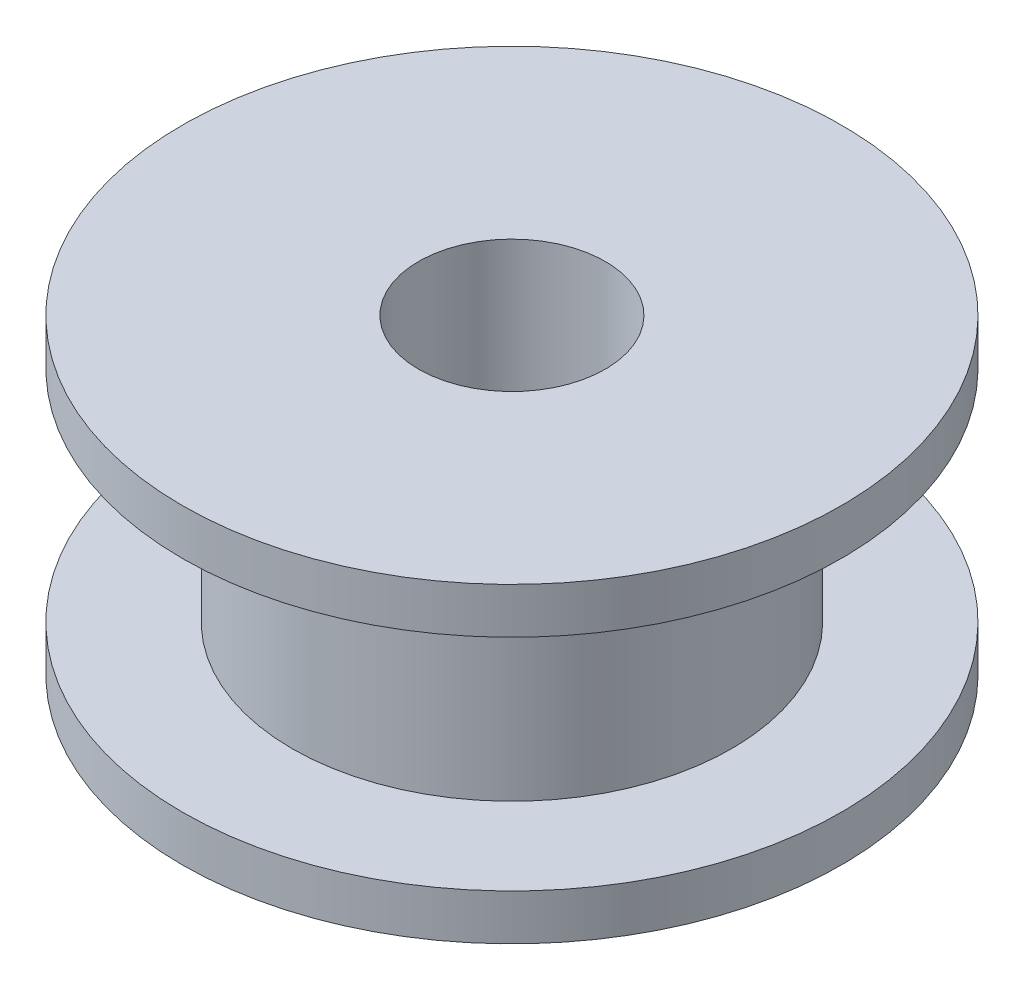
from build123d import *

# Parameters (mm, degrees)
SKETCH_1_R          = 6
EXTRUDE_1_DEPTH     = 3
SKETCH_3_R          = 9
EXTRUDE_2_DEPTH     = 1.25
SKETCH_4_R          = 2.55
CUT_EXTRUDE_1_DEPTH = 16.305227865


with BuildPart() as part:
    # 草图1 → 凸台-拉伸1 (new, symmetric)
    with BuildSketch(Plane(origin=(0, 0, 0), x_dir=(1, 0, 0), z_dir=(0, 1, 0))):
        with Locations(Location((0, 0, 0), (0, 0, 270))):
            Circle(SKETCH_1_R)
    extrude(amount=EXTRUDE_1_DEPTH, both=True)

    # 草图3 → 凸台-拉伸2 (add)
    with BuildSketch(Plane(origin=(0, 3, 0), x_dir=(1, 0, 0), z_dir=(0, 1, 0))):
        with Locations(Location((0, 0, 0), (0, 0, 270))):
            Circle(SKETCH_3_R)
    extrude_2 = extrude(amount=EXTRUDE_2_DEPTH)

    # 镜向1: 凸台-拉伸2 across plane
    add(extrude_2.mirror(Plane.ZX))

    # 草图4 → 切除-拉伸1 (cut, through all)
    with BuildSketch(Plane(origin=(0, 4.25, 0), x_dir=(1, 0, 0), z_dir=(0, 1, 0))):
        with Locations(Location((0, 0, 0), (0, 0, 270))):
            Circle(SKETCH_4_R)
    extrude(amount=-CUT_EXTRUDE_1_DEPTH, mode=Mode.SUBTRACT)


solid = part.part
